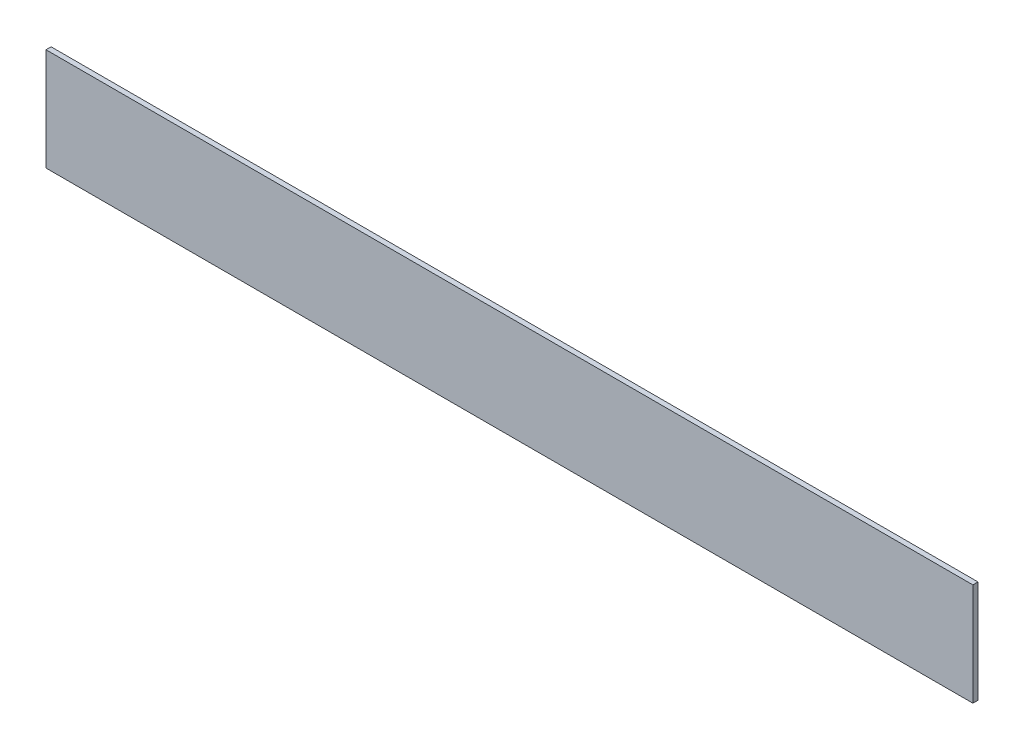
from build123d import *

# Parameters (mm, degrees)
SKETCH1_W           = 1809
SKETCH1_H           = 200
BOSS_EXTRUDE1_DEPTH = 10


with BuildPart() as part:
    # Sketch1 → Boss-Extrude1 (new body)
    with BuildSketch(Plane.XY):
        Rectangle(SKETCH1_W, SKETCH1_H)
    extrude(amount=BOSS_EXTRUDE1_DEPTH)


solid = part.part
